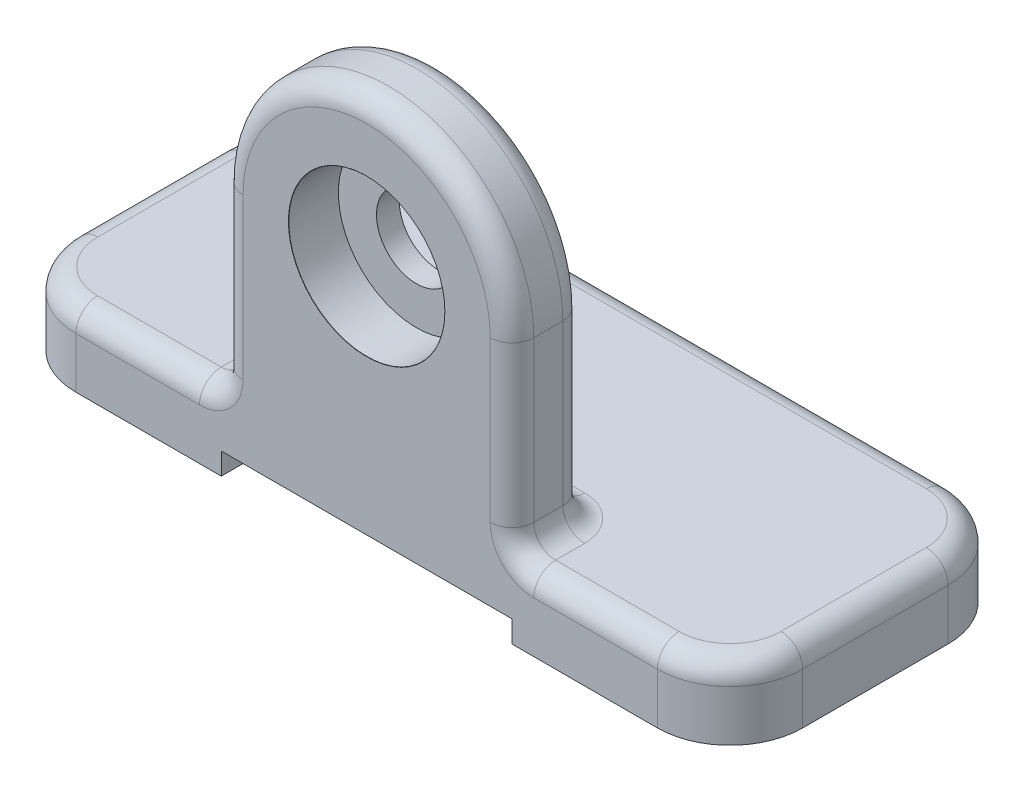
from build123d import *

# Parameters (mm, degrees)
SKETCH3_W           = 100
SKETCH3_H           = 40
BOSS_EXTRUDE1_DEPTH = 10
BOSS_EXTRUDE2_DEPTH = 10
SKETCH5_W           = 40
SKETCH5_H           = 3
CUT_EXTRUDE1_DEPTH  = 85.409715081
FILLET1_R           = 10
FILLET2_R           = 3


with BuildPart() as part:
    # Sketch3 → Boss-Extrude1 (new body)
    with BuildSketch(Plane(origin=(0, 0, 0), x_dir=(1, 0, 0), z_dir=(0, 1, 0))):
        with Locations((0, 20)):
            Rectangle(SKETCH3_W, SKETCH3_H)
    extrude(amount=BOSS_EXTRUDE1_DEPTH)

    # Sketch4 → Boss-Extrude2 (add)
    with BuildSketch(Plane.XY):
        with BuildLine():
            Line((-20, 0), (-20, 35))
            ThreePointArc((-20, 35), (0, 55), (20, 35))
            Line((20, 35), (20, 0))
            Line((20, 0), (-20, 0))
        make_face()
    extrude(amount=-BOSS_EXTRUDE2_DEPTH)

    # Sketch5 → Cut-Extrude1 (cut, through all)
    with BuildSketch(Plane.XY):
        with Locations((0, 1.5)):
            Rectangle(SKETCH5_W, SKETCH5_H)
    extrude(amount=-CUT_EXTRUDE1_DEPTH, mode=Mode.SUBTRACT)

    # Sketch6 → CBORE for M10 Hex Head Bolt1 (revolve, cut)
    with BuildSketch(Plane(origin=(0, 35, 0), x_dir=(0, -1, 0), z_dir=(1, 0, 0))):
        Polygon((0, 0), (0, 40), (5.5, 40), (5.5, 6.85), (10.74, 6.85), (10.74, 0.025), (10.765, 0), align=None)
    revolve(axis=Axis((0, 35, 6.35), (0, 0, -1)), mode=Mode.SUBTRACT)

    # Fillet1
    fillet1_edges = [part.edges().sort_by_distance(p)[0] for p in [
        (-50, 5, -40),
        (50, 5, -40),
        (50, 5, 0),
        (-50, 5, 0),
    ]]
    fillet(fillet1_edges, radius=FILLET1_R)

    # Fillet2
    fillet2_edges = [part.edges().sort_by_distance(p)[0] for p in [
        (30, 10, 0),
        (-20, 22.5, -10),
        (20, 22.5, -10),
        (-20, 22.5, 0),
        (20, 22.5, 0),
        (0, 55, 0),
        (-20, 10, -5),
        (0, 55, -10),
        (20, 10, -5),
        (0, 10, -10),
        (0, 10, -40),
        (50, 10, -20),
        (-30, 10, 0),
        (-50, 10, -20),
        (-47.071067812, 10, -37.071067812),
        (-47.071067812, 10, -2.928932188),
        (47.071067812, 10, -2.928932188),
        (47.071067812, 10, -37.071067812),
    ]]
    fillet(fillet2_edges, radius=FILLET2_R)


solid = part.part
